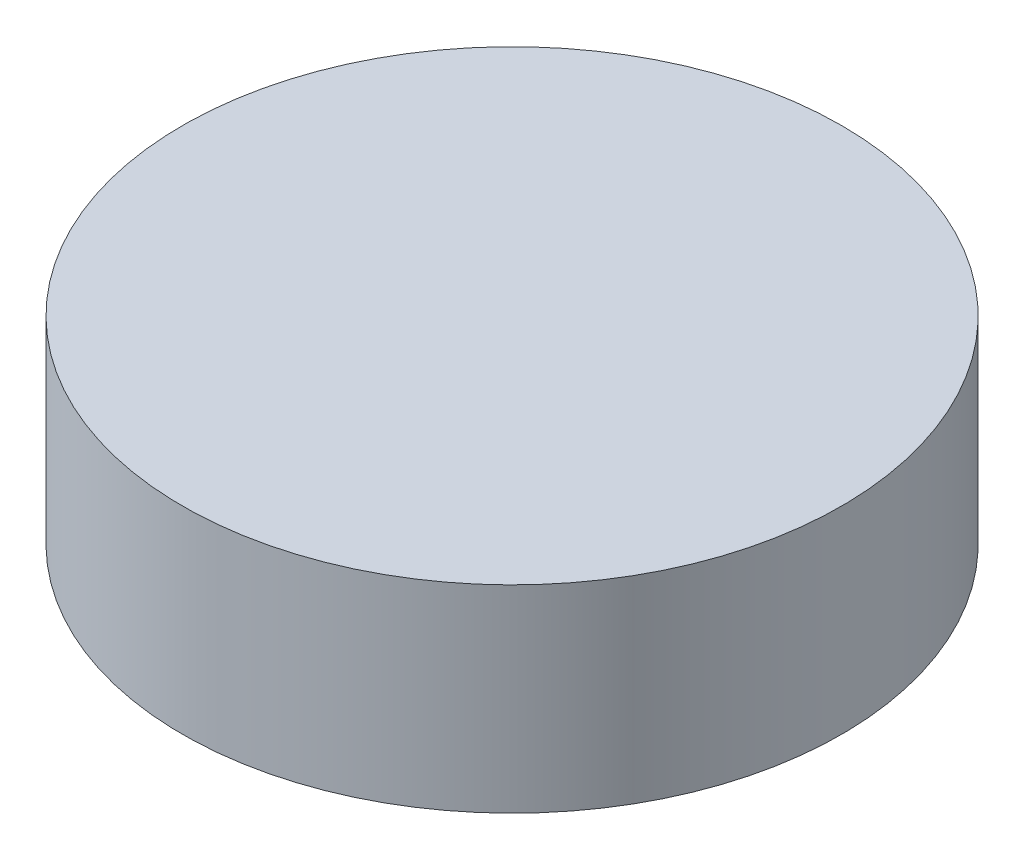
from build123d import *

# Parameters (mm, degrees)
SKETCH1_R           = 127
BOSS_EXTRUDE1_DEPTH = 76.2


with BuildPart() as part:
    # Sketch1 → Boss-Extrude1 (new body)
    with BuildSketch(Plane(origin=(0, 0, 0), x_dir=(1, 0, 0), z_dir=(0, 1, 0))):
        with Locations(Location((0, 0, 0), (0, 0, 90))):
            Circle(SKETCH1_R)
    extrude(amount=BOSS_EXTRUDE1_DEPTH)


solid = part.part
